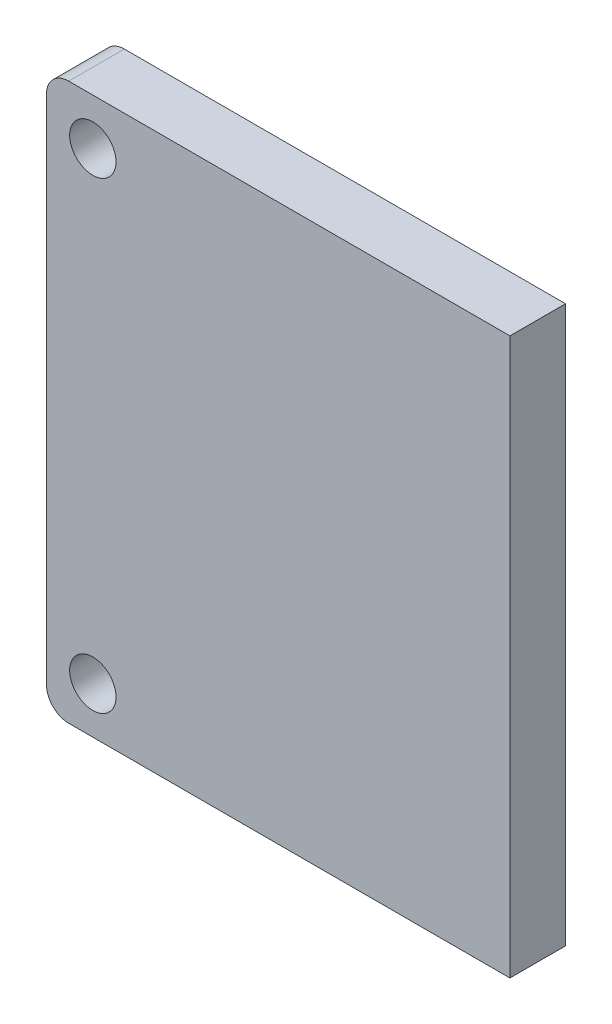
from build123d import *

# Parameters (mm, degrees)
SKETCH_1_R      = 1.25
EXTRUDE_1_DEPTH = 3


with BuildPart() as part:
    # 草图1 → 凸台-拉伸1 (new body)
    with BuildSketch(Plane.XY):
        with BuildLine():
            Line((24.999999642, 30), (24.999999642, 0))
            Line((24.999999642, 0), (1.200000048, 0))
            ThreePointArc((1.200000048, 0), (0.351000011, 0.351000011), (0, 1.200000048))
            Line((0, 1.200000048), (0, 28.799999237))
            ThreePointArc((0, 28.799999237), (0.350999669, 29.648999825), (1.200000048, 30))
            Line((1.200000048, 30), (24.999999642, 30))
        make_face()
        with Locations((2.5, 2.5)):
            Circle(SKETCH_1_R, mode=Mode.SUBTRACT)
        with Locations((2.5, 27.5)):
            Circle(SKETCH_1_R, mode=Mode.SUBTRACT)
    extrude(amount=EXTRUDE_1_DEPTH)


solid = part.part
